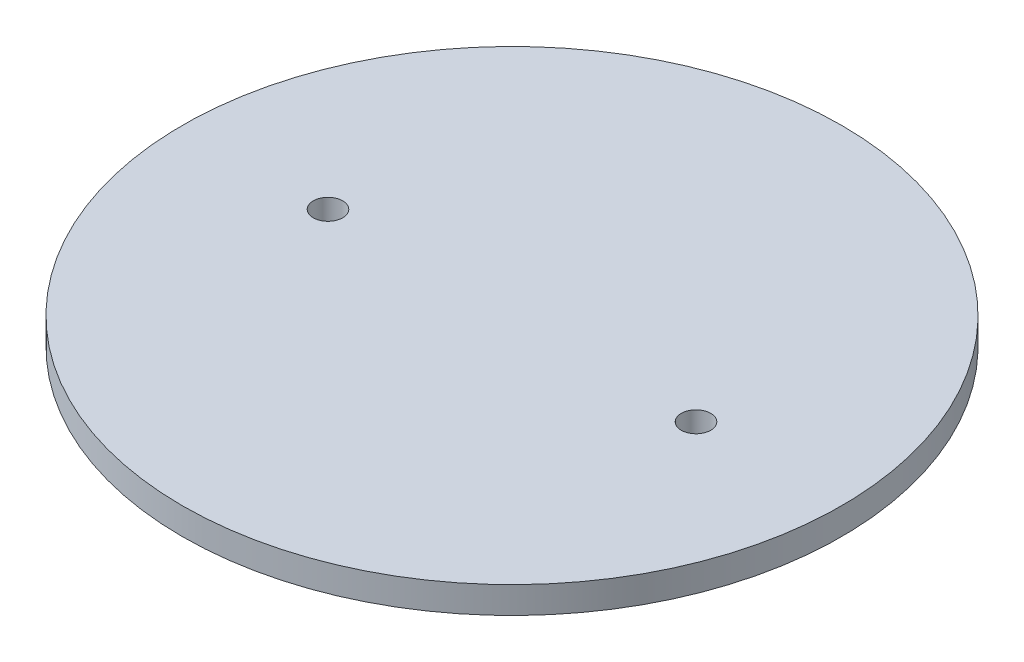
from build123d import *

# Parameters (mm, degrees)
SKETCH1_R           = 49.25
SKETCH1_R_2         = 2.2
BOSS_EXTRUDE1_DEPTH = 4


with BuildPart() as part:
    # Sketch1 → Boss-Extrude1 (new body)
    with BuildSketch(Plane(origin=(0, 0, 0), x_dir=(1, 0, 0), z_dir=(0, 1, 0))):
        with Locations(Location((0, 0, 0), (0, 0, 270))):
            Circle(SKETCH1_R)
        with Locations(Location((-27.5, 0, 0), (0, 0, 270))):
            Circle(SKETCH1_R_2, mode=Mode.SUBTRACT)
        with Locations(Location((27.5, 0, 0), (0, 0, 270))):
            Circle(SKETCH1_R_2, mode=Mode.SUBTRACT)
    extrude(amount=BOSS_EXTRUDE1_DEPTH)


solid = part.part
